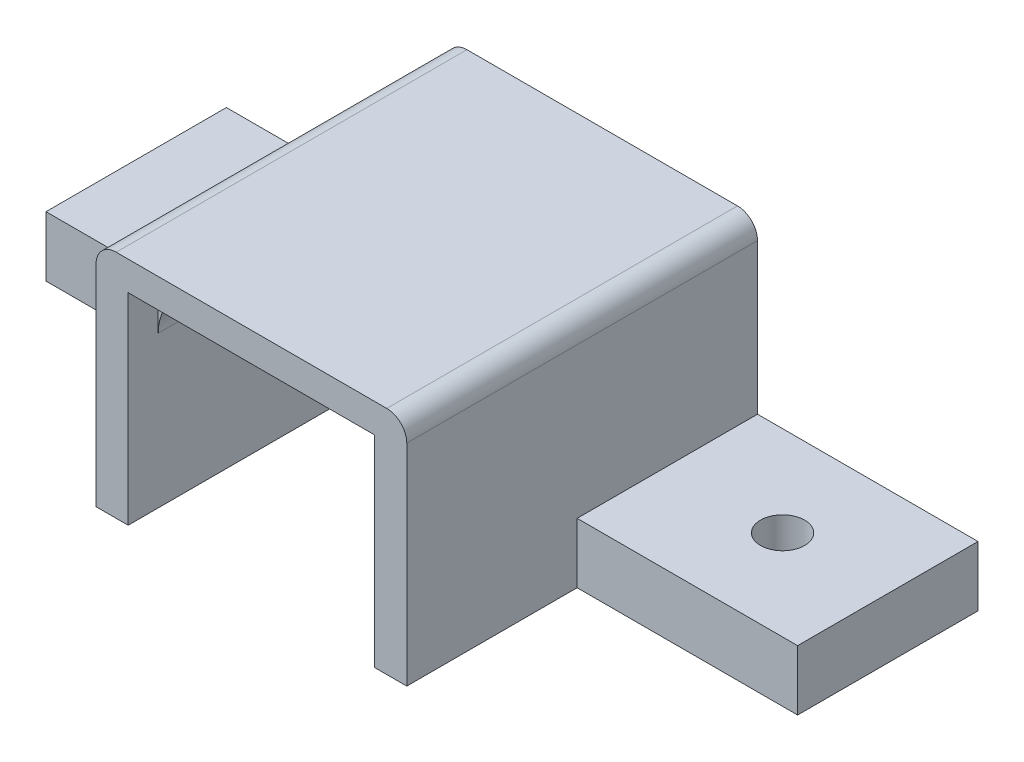
from build123d import *

# Parameters (mm, degrees)
CROQUIS1_W               = 15.5
CROQUIS1_H               = 17.5
SALIENTE_EXTRUIR1_DEPTH  = 11.5
CROQUIS2_W               = 12.3
CROQUIS2_H               = 10.05
CORTAR_EXTRUIR1_DEPTH    = 23.328513161
REDONDEO1_R              = 1
CROQUIS3_W               = 9
CROQUIS3_H               = 3
SALIENTE_EXTRUIR4_DEPTH  = 11
CROQUIS12_R              = 1.1
CORTAR_EXTRUIR7_DEPTH    = 23.369063458
CROQUIS13_W              = 18.078388853
CROQUIS13_H              = 17.5
CORTAR_EXTRUIR8_DEPTH    = 24.672241128
REDONDEO1_OF_SIMETR_A2_R = 1
REDONDEO6_R              = 2
CROQUIS15_W              = 6.15
CROQUIS15_H              = 1.2
CROQUIS15_H_2            = 1
CROQUIS15_H_3            = 1.5
CORTAR_EXTRUIR10_DEPTH   = 10.05
CROQUIS17_W              = 2.5
CROQUIS17_H              = 4
SALIENTE_EXTRUIR6_DEPTH  = 2.5
CROQUIS19_R              = 2.5
CORTAR_EXTRUIR12_DEPTH   = 4
CROQUIS20_W              = 2
CROQUIS20_H              = 1.8
CORTAR_EXTRUIR13_DEPTH   = 7.05


with BuildPart() as part:
    # Croquis1 → Saliente-Extruir1 (new body)
    with BuildSketch(Plane(origin=(0, 0, 0), x_dir=(1, 0, 0), z_dir=(0, 1, 0))):
        Rectangle(CROQUIS1_W, CROQUIS1_H)
    saliente_extruir1 = extrude(amount=SALIENTE_EXTRUIR1_DEPTH)

    # Croquis2 → Cortar-Extruir1 (cut, through all)
    with BuildSketch(Plane.XY.offset(8.75)):
        with Locations((0, 5.025)):
            Rectangle(CROQUIS2_W, CROQUIS2_H)
    cortar_extruir1 = extrude(amount=-CORTAR_EXTRUIR1_DEPTH, mode=Mode.SUBTRACT)

    # Redondeo1
    redondeo1_edges = [part.edges().sort_by_distance(p)[0] for p in [
        (7.75, 11.5, 0),
        (-7.75, 11.5, 0),
    ]]
    fillet(redondeo1_edges, radius=REDONDEO1_R)

    # Croquis13 → Cortar-Extruir8 (cut, through all)
    with BuildSketch(Plane(origin=(0, 11.5, 0), x_dir=(1, 0, 0), z_dir=(0, 1, 0))):
        with Locations((-9.039194426, 0)):
            Rectangle(CROQUIS13_W, CROQUIS13_H)
    extrude(amount=-CORTAR_EXTRUIR8_DEPTH, mode=Mode.SUBTRACT)

    # Simetría2: Saliente-Extruir1 across plane
    add(saliente_extruir1.mirror(Plane(origin=(0, 0, -8.75), x_dir=(0, 0, 1), z_dir=(1, 0, 0))))

    # Simetr_a2 2: Cortar-Extruir1 across plane
    add(cortar_extruir1.mirror(Plane(origin=(0, 0, -8.75), x_dir=(0, 0, 1), z_dir=(1, 0, 0))), mode=Mode.SUBTRACT)


with BuildPart() as body_2:
    # Croquis3 → Saliente-Extruir4 (new body)
    with BuildSketch(Plane(origin=(7.75, 0, 0), x_dir=(0, 0, -1), z_dir=(1, 0, 0))):
        with Locations((4.25, 1.5)):
            Rectangle(CROQUIS3_W, CROQUIS3_H)
    saliente_extruir4 = extrude(amount=SALIENTE_EXTRUIR4_DEPTH)

    # Croquis12 → Cortar-Extruir7 (cut, through all)
    with BuildSketch(Plane(origin=(0, 3, 0), x_dir=(1, 0, 0), z_dir=(0, 1, 0))):
        with Locations(Location((13.5, 4.25, 0), (0, 0, 270))):
            Circle(CROQUIS12_R)
    cortar_extruir7 = extrude(amount=-CORTAR_EXTRUIR7_DEPTH, mode=Mode.SUBTRACT)


with BuildPart() as part_1:
    add(part.part)

    # Simetr_a2 3: Saliente-Extruir4 across plane
    add(saliente_extruir4.mirror(Plane(origin=(0, 0, -8.75), x_dir=(0, 0, 1), z_dir=(1, 0, 0))))

    # Simetr_a2 4: Cortar-Extruir7 across plane
    add(cortar_extruir7.mirror(Plane(origin=(0, 0, -8.75), x_dir=(0, 0, 1), z_dir=(1, 0, 0))), mode=Mode.SUBTRACT)

    # Redondeo1 of Simetría2
    redondeo1_of_simetr_a2_edges = [part_1.edges().sort_by_distance(p)[0] for p in [
        (-7.75, 11.5, 0),
        (7.75, 11.5, 0),
    ]]
    fillet(redondeo1_of_simetr_a2_edges, radius=REDONDEO1_OF_SIMETR_A2_R)

    # Combinar3: union body 2
    add(body_2.part)

    # Redondeo6
    redondeo6_edges = [part_1.edges().sort_by_distance(p)[0] for p in [
        (6.15, 10.05, 0),
        (-6.15, 10.05, 0),
    ]]
    fillet(redondeo6_edges, radius=REDONDEO6_R)

    # Croquis15 → Cortar-Extruir10 (cut)
    with BuildSketch(Plane(origin=(0, 0, 0), x_dir=(-1, 0, 0), z_dir=(0, -1, 0))):
        with Locations((-3.075, 0.15)):
            Rectangle(CROQUIS15_W, CROQUIS15_H)
        with Locations((-3.075, -2.75)):
            Rectangle(CROQUIS15_W, CROQUIS15_H_2)
        with Locations((-3.075, -8)):
            Rectangle(CROQUIS15_W, CROQUIS15_H_3)
        Polygon((6.15, 0.75), (0, 0.75), (0, -0.45), (0, -2.25), (0, -3.25), (0, -7.25), (0, -8.75), (6.15, -8.75), align=None)
    extrude(amount=-CORTAR_EXTRUIR10_DEPTH, mode=Mode.SUBTRACT)

    # Croquis17 → Saliente-Extruir6 (add)
    with BuildSketch(Plane.XZ.offset(-10.05)):
        with Locations((-4.9, 5.25)):
            Rectangle(CROQUIS17_W, CROQUIS17_H)
    extrude(amount=SALIENTE_EXTRUIR6_DEPTH)

    # Croquis19 → Cortar-Extruir12 (cut)
    with BuildSketch(Plane.XY.offset(7.25)):
        with Locations((-3.65, 7.55)):
            Circle(CROQUIS19_R)
    extrude(amount=-CORTAR_EXTRUIR12_DEPTH, mode=Mode.SUBTRACT)

    # Croquis20 → Cortar-Extruir13 (cut)
    with BuildSketch(Plane.XZ.offset(-10.05)):
        with Locations((5.15, 1.35)):
            Rectangle(CROQUIS20_W, CROQUIS20_H)
    extrude(amount=CORTAR_EXTRUIR13_DEPTH, mode=Mode.SUBTRACT)


solid = part_1.part
